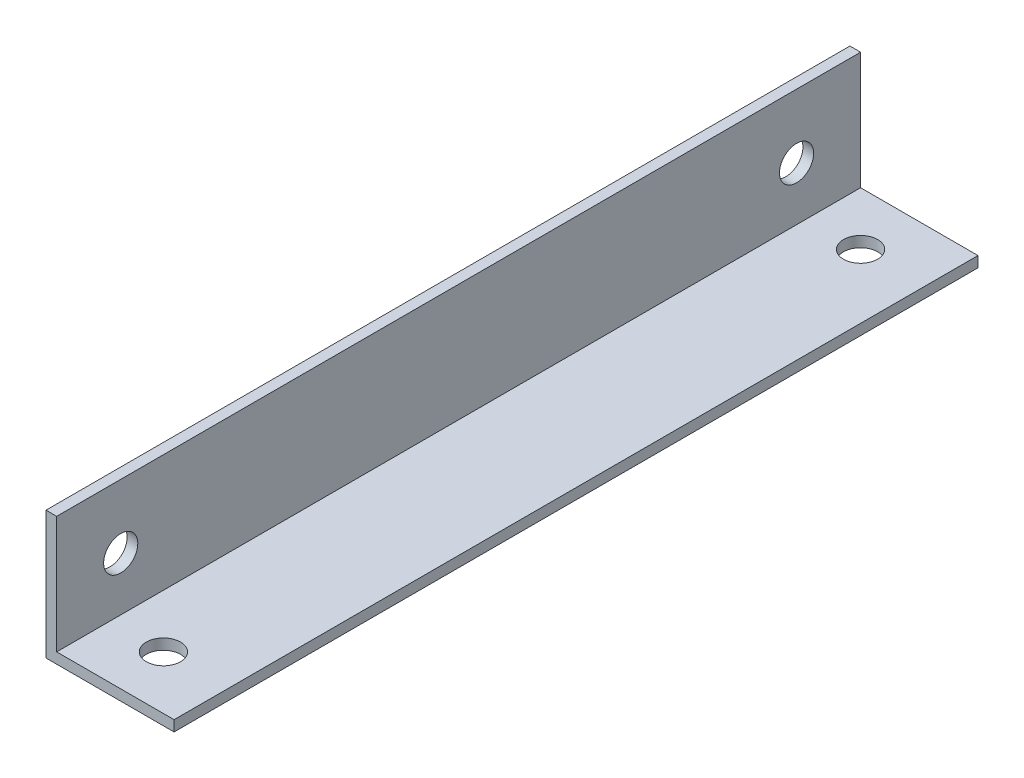
from build123d import *

# Parameters (mm, degrees)
BOSS_EXTRUDE1_DEPTH = 188.3
SKETCH2_R           = 4
CUT_EXTRUDE1_DEPTH  = 193.647709563
SKETCH3_R           = 4
CUT_EXTRUDE2_DEPTH  = 193.647709563


with BuildPart() as part:
    # Sketch1 → Boss-Extrude1 (new body)
    with BuildSketch(Plane.XY):
        Polygon((0, 0), (0, 30), (2.5, 30), (2.5, 2.5), (30, 2.5), (30, 0), align=None)
    extrude(amount=BOSS_EXTRUDE1_DEPTH)

    # Sketch2 → Cut-Extrude1 (cut, through all)
    with BuildSketch(Plane(origin=(0, 2.5, 0), x_dir=(1, 0, 0), z_dir=(0, 1, 0))):
        with Locations(Location((15, -12.5, 0), (0, 0, 180))):
            Circle(SKETCH2_R)
        with Locations(Location((15, -175.8, 0), (0, 0, 180))):
            Circle(SKETCH2_R)
    extrude(amount=-CUT_EXTRUDE1_DEPTH, mode=Mode.SUBTRACT)

    # Sketch3 → Cut-Extrude2 (cut, through all)
    with BuildSketch(Plane(origin=(2.5, 0, 0), x_dir=(0, 0, -1), z_dir=(1, 0, 0))):
        with Locations(Location((-15, 15, 0), (0, 0, 90))):
            Circle(SKETCH3_R)
        with Locations(Location((-173.3, 15, 0), (0, 0, 270))):
            Circle(SKETCH3_R)
    extrude(amount=-CUT_EXTRUDE2_DEPTH, mode=Mode.SUBTRACT)


solid = part.part
